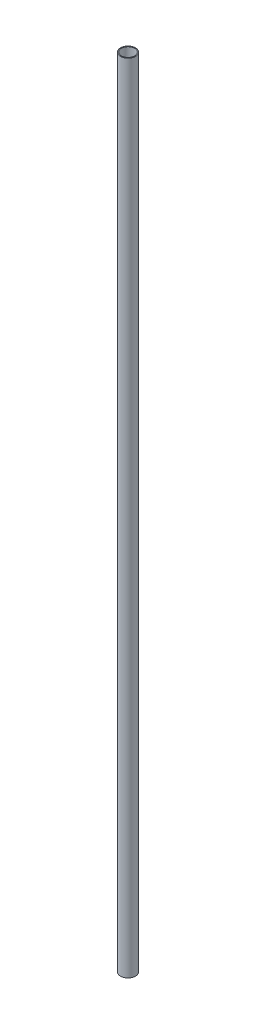
from build123d import *

# Parameters (mm, degrees)
SKETCH1_R           = 3.81
SKETCH1_R_2         = 3.3655
BOSS_EXTRUDE1_DEPTH = 406.4


with BuildPart() as part:
    # Sketch1 → Boss-Extrude1 (new body)
    with BuildSketch(Plane(origin=(0, 0, 0), x_dir=(1, 0, 0), z_dir=(0, 1, 0))):
        with Locations(Location((0, 0, 0), (0, 0, 270))):
            Circle(SKETCH1_R)
        with Locations(Location((0, 0, 0), (0, 0, 270))):
            Circle(SKETCH1_R_2, mode=Mode.SUBTRACT)
    extrude(amount=BOSS_EXTRUDE1_DEPTH)


solid = part.part
